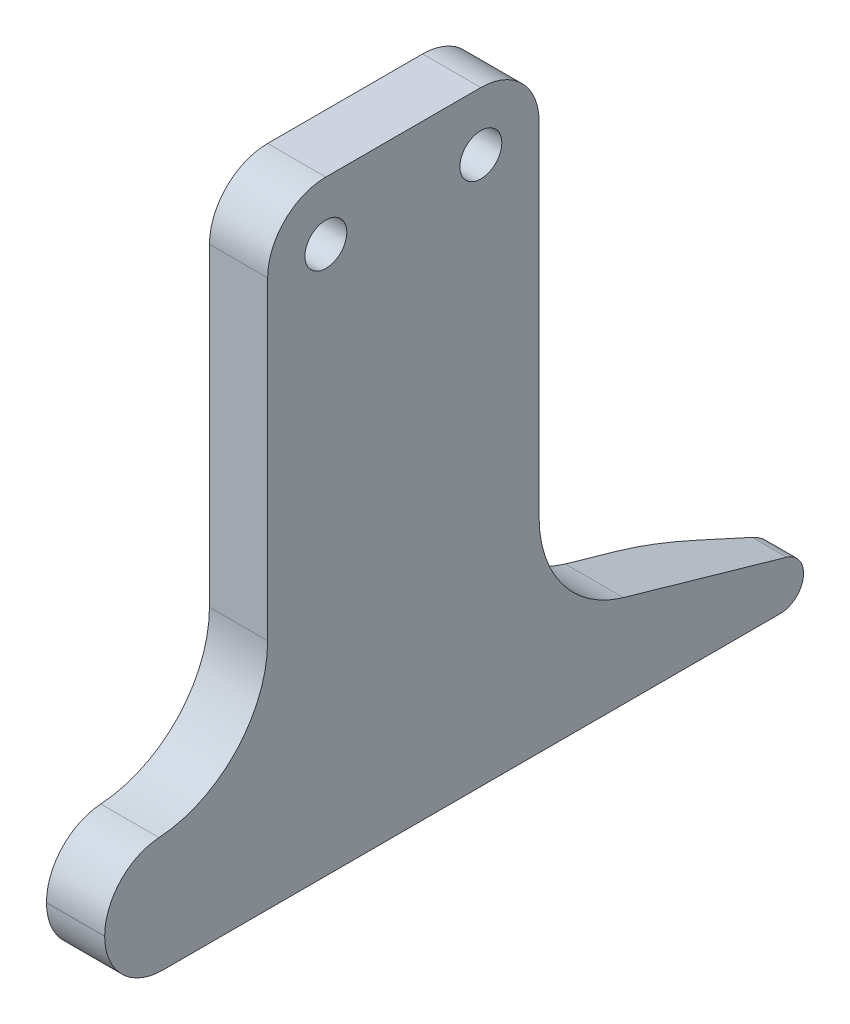
from build123d import *

# Parameters (mm, degrees)
SKETCH1_R           = 2.286
BOSS_EXTRUDE1_DEPTH = 6.35
FILLET1_R           = 12.7
FILLET2_R           = 6.35
FILLET3_R           = 2.54
CUT_EXTRUDE1_DEPTH  = 85.366399734
FILLET4_R           = 25.4


with BuildPart() as part:
    # Sketch1 → Boss-Extrude1 (new body)
    with BuildSketch(Plane(origin=(0, 0, 0), x_dir=(0, 0, -1), z_dir=(1, 0, 0))):
        Polygon((-6.35, 6.35), (-6.35, -46.99), (-24.13, -46.99), (-24.13, -59.69), (67.711814614, -59.69), (23.261814614, -46.99), (23.261814614, 6.35), align=None)
        Circle(SKETCH1_R, mode=Mode.SUBTRACT)
        with Locations((16.911814614, 0)):
            Circle(SKETCH1_R, mode=Mode.SUBTRACT)
    extrude(amount=BOSS_EXTRUDE1_DEPTH)

    # Fillet1
    fillet1_edges = [part.edges().sort_by_distance(p)[0] for p in [
        (3.175, -46.99, -23.261814614),
        (3.175, -46.99, 6.35),
    ]]
    fillet(fillet1_edges, radius=FILLET1_R)

    # Fillet2
    fillet2_edges = [part.edges().sort_by_distance(p)[0] for p in [
        (3.175, 6.35, 6.35),
        (3.175, 6.35, -23.261814614),
        (3.175, -59.69, 24.13),
        (3.175, -46.99, 24.13),
    ]]
    fillet(fillet2_edges, radius=FILLET2_R)

    # Fillet3
    fillet3_edges = [part.edges().sort_by_distance(p)[0] for p in [
        (3.175, -59.69, -67.711814614),
    ]]
    fillet(fillet3_edges, radius=FILLET3_R)

    # Sketch2 → Cut-Extrude1 (cut, through all)
    with BuildSketch(Plane.XZ.offset(59.69)):
        Polygon((0, -41.956075055), (3.175, -52.116075055), (0, -52.116075055), align=None)
    extrude(amount=-CUT_EXTRUDE1_DEPTH, mode=Mode.SUBTRACT)

    # Fillet4
    fillet4_edges = [part.edges().sort_by_distance(p)[0] for p in [
        (0, -56.010608634, -41.956075055),
    ]]
    fillet(fillet4_edges, radius=FILLET4_R)


solid = part.part
